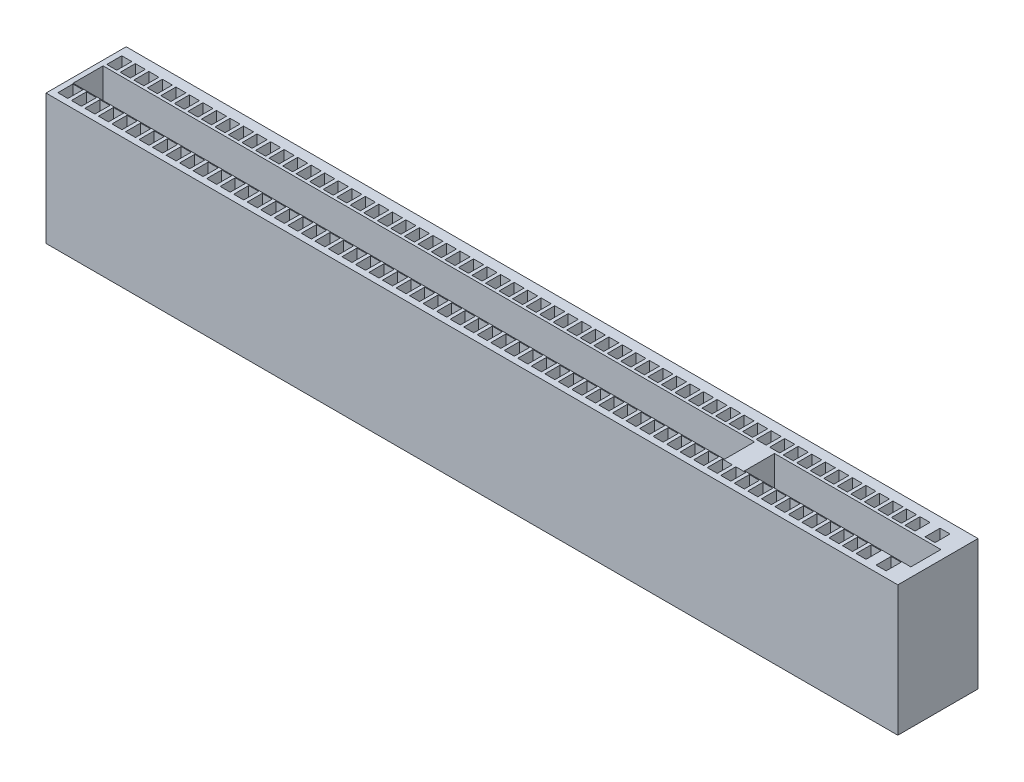
from build123d import *

# Parameters (mm, degrees)
SKETCH1_W           = 85
SKETCH1_H           = 8
BOSS_EXTRUDE1_DEPTH = 13
SKETCH2_W           = 2.481946124
SKETCH2_H           = 2.030683192
SKETCH2_W_2         = 2.594761857
SKETCH2_H_2         = 2.820393322
BOSS_EXTRUDE2_DEPTH = 1
SKETCH3_W           = 65
SKETCH3_H           = 3
SKETCH3_W_2         = 16.59944138
CUT_EXTRUDE2_DEPTH  = 10
SKETCH4_W           = 1
SKETCH4_H           = 1.5
CUT_EXTRUDE3_DEPTH  = 10


with BuildPart() as part:
    # Sketch1 → Boss-Extrude1 (new body)
    with BuildSketch(Plane(origin=(0, 0, 0), x_dir=(1, 0, 0), z_dir=(0, 1, 0))):
        with Locations((42.5, 4)):
            Rectangle(SKETCH1_W, SKETCH1_H)
    extrude(amount=BOSS_EXTRUDE1_DEPTH)

    # Sketch2 → Boss-Extrude2 (add)
    with BuildSketch(Plane.XZ):
        with Locations((81.308612117, -2.109090044)):
            Rectangle(SKETCH2_W, SKETCH2_H)
        with Locations((81.308612117, -6.283272161)):
            Rectangle(SKETCH2_W, SKETCH2_H)
        with Locations((3.74779575, -2.503945109)):
            Rectangle(SKETCH2_W_2, SKETCH2_H_2)
        with Locations((3.74779575, -6.283272161)):
            Rectangle(SKETCH2_W_2, SKETCH2_H)
    extrude(amount=BOSS_EXTRUDE2_DEPTH)

    # Sketch3 → Cut-Extrude2 (cut)
    with BuildSketch(Plane(origin=(0, 13, 0), x_dir=(1, 0, 0), z_dir=(0, 1, 0))):
        with Locations((33, 3.7)):
            Rectangle(SKETCH3_W, SKETCH3_H)
        with Locations((75.79972069, 3.7)):
            Rectangle(SKETCH3_W_2, SKETCH3_H)
    extrude(amount=-CUT_EXTRUDE2_DEPTH, mode=Mode.SUBTRACT)

    # Sketch4 → Cut-Extrude3 (cut)
    with BuildSketch(Plane(origin=(0, 13, 0), x_dir=(1, 0, 0), z_dir=(0, 1, 0))):
        with Locations((82.71113798, 6.25)):
            Rectangle(SKETCH4_W, SKETCH4_H)
        with Locations((80.71113798, 6.25)):
            Rectangle(SKETCH4_W, SKETCH4_H)
        with Locations((79.36113798, 6.25)):
            Rectangle(SKETCH4_W, SKETCH4_H)
        with Locations((78.01113798, 6.25)):
            Rectangle(SKETCH4_W, SKETCH4_H)
        with Locations((76.66113798, 6.25)):
            Rectangle(SKETCH4_W, SKETCH4_H)
        with Locations((75.31113798, 6.25)):
            Rectangle(SKETCH4_W, SKETCH4_H)
        with Locations((73.96113798, 6.25)):
            Rectangle(SKETCH4_W, SKETCH4_H)
        with Locations((72.61113798, 6.25)):
            Rectangle(SKETCH4_W, SKETCH4_H)
        with Locations((71.26113798, 6.25)):
            Rectangle(SKETCH4_W, SKETCH4_H)
        with Locations((69.91113798, 6.25)):
            Rectangle(SKETCH4_W, SKETCH4_H)
        with Locations((68.56113798, 6.25)):
            Rectangle(SKETCH4_W, SKETCH4_H)
        with Locations((67.21113798, 6.25)):
            Rectangle(SKETCH4_W, SKETCH4_H)
        with Locations((65.86113798, 6.25)):
            Rectangle(SKETCH4_W, SKETCH4_H)
        with Locations((64.51113798, 6.25)):
            Rectangle(SKETCH4_W, SKETCH4_H)
        with Locations((63.16113798, 6.25)):
            Rectangle(SKETCH4_W, SKETCH4_H)
        with Locations((61.81113798, 6.25)):
            Rectangle(SKETCH4_W, SKETCH4_H)
        with Locations((60.46113798, 6.25)):
            Rectangle(SKETCH4_W, SKETCH4_H)
        with Locations((59.11113798, 6.25)):
            Rectangle(SKETCH4_W, SKETCH4_H)
        with Locations((57.76113798, 6.25)):
            Rectangle(SKETCH4_W, SKETCH4_H)
        with Locations((56.41113798, 6.25)):
            Rectangle(SKETCH4_W, SKETCH4_H)
        with Locations((55.06113798, 6.25)):
            Rectangle(SKETCH4_W, SKETCH4_H)
        with Locations((53.71113798, 6.25)):
            Rectangle(SKETCH4_W, SKETCH4_H)
        with Locations((52.36113798, 6.25)):
            Rectangle(SKETCH4_W, SKETCH4_H)
        with Locations((51.01113798, 6.25)):
            Rectangle(SKETCH4_W, SKETCH4_H)
        with Locations((49.66113798, 6.25)):
            Rectangle(SKETCH4_W, SKETCH4_H)
        with Locations((48.31113798, 6.25)):
            Rectangle(SKETCH4_W, SKETCH4_H)
        with Locations((46.96113798, 6.25)):
            Rectangle(SKETCH4_W, SKETCH4_H)
        with Locations((45.61113798, 6.25)):
            Rectangle(SKETCH4_W, SKETCH4_H)
        with Locations((44.26113798, 6.25)):
            Rectangle(SKETCH4_W, SKETCH4_H)
        with Locations((42.91113798, 6.25)):
            Rectangle(SKETCH4_W, SKETCH4_H)
        with Locations((41.56113798, 6.25)):
            Rectangle(SKETCH4_W, SKETCH4_H)
        with Locations((40.21113798, 6.25)):
            Rectangle(SKETCH4_W, SKETCH4_H)
        with Locations((38.86113798, 6.25)):
            Rectangle(SKETCH4_W, SKETCH4_H)
        with Locations((37.51113798, 6.25)):
            Rectangle(SKETCH4_W, SKETCH4_H)
        with Locations((36.16113798, 6.25)):
            Rectangle(SKETCH4_W, SKETCH4_H)
        with Locations((34.81113798, 6.25)):
            Rectangle(SKETCH4_W, SKETCH4_H)
        with Locations((33.46113798, 6.25)):
            Rectangle(SKETCH4_W, SKETCH4_H)
        with Locations((32.11113798, 6.25)):
            Rectangle(SKETCH4_W, SKETCH4_H)
        with Locations((30.76113798, 6.25)):
            Rectangle(SKETCH4_W, SKETCH4_H)
        with Locations((29.41113798, 6.25)):
            Rectangle(SKETCH4_W, SKETCH4_H)
        with Locations((28.06113798, 6.25)):
            Rectangle(SKETCH4_W, SKETCH4_H)
        with Locations((26.71113798, 6.25)):
            Rectangle(SKETCH4_W, SKETCH4_H)
        with Locations((25.36113798, 6.25)):
            Rectangle(SKETCH4_W, SKETCH4_H)
        with Locations((24.01113798, 6.25)):
            Rectangle(SKETCH4_W, SKETCH4_H)
        with Locations((22.66113798, 6.25)):
            Rectangle(SKETCH4_W, SKETCH4_H)
        with Locations((21.31113798, 6.25)):
            Rectangle(SKETCH4_W, SKETCH4_H)
        with Locations((19.96113798, 6.25)):
            Rectangle(SKETCH4_W, SKETCH4_H)
        with Locations((18.61113798, 6.25)):
            Rectangle(SKETCH4_W, SKETCH4_H)
        with Locations((17.26113798, 6.25)):
            Rectangle(SKETCH4_W, SKETCH4_H)
        with Locations((15.91113798, 6.25)):
            Rectangle(SKETCH4_W, SKETCH4_H)
        with Locations((14.56113798, 6.25)):
            Rectangle(SKETCH4_W, SKETCH4_H)
        with Locations((13.21113798, 6.25)):
            Rectangle(SKETCH4_W, SKETCH4_H)
        with Locations((11.86113798, 6.25)):
            Rectangle(SKETCH4_W, SKETCH4_H)
        with Locations((10.51113798, 6.25)):
            Rectangle(SKETCH4_W, SKETCH4_H)
        with Locations((9.16113798, 6.25)):
            Rectangle(SKETCH4_W, SKETCH4_H)
        with Locations((7.81113798, 6.25)):
            Rectangle(SKETCH4_W, SKETCH4_H)
        with Locations((6.46113798, 6.25)):
            Rectangle(SKETCH4_W, SKETCH4_H)
        with Locations((5.11113798, 6.25)):
            Rectangle(SKETCH4_W, SKETCH4_H)
        with Locations((3.76113798, 6.25)):
            Rectangle(SKETCH4_W, SKETCH4_H)
        with Locations((2.41113798, 6.25)):
            Rectangle(SKETCH4_W, SKETCH4_H)
        with Locations((1.06113798, 6.25)):
            Rectangle(SKETCH4_W, SKETCH4_H)
        with Locations((1.06113798, 1.370144263)):
            Rectangle(SKETCH4_W, SKETCH4_H)
        with Locations((2.41113798, 1.370144263)):
            Rectangle(SKETCH4_W, SKETCH4_H)
        with Locations((3.76113798, 1.370144263)):
            Rectangle(SKETCH4_W, SKETCH4_H)
        with Locations((5.11113798, 1.370144263)):
            Rectangle(SKETCH4_W, SKETCH4_H)
        with Locations((6.46113798, 1.370144263)):
            Rectangle(SKETCH4_W, SKETCH4_H)
        with Locations((7.81113798, 1.370144263)):
            Rectangle(SKETCH4_W, SKETCH4_H)
        with Locations((9.16113798, 1.370144263)):
            Rectangle(SKETCH4_W, SKETCH4_H)
        with Locations((10.51113798, 1.370144263)):
            Rectangle(SKETCH4_W, SKETCH4_H)
        with Locations((11.86113798, 1.370144263)):
            Rectangle(SKETCH4_W, SKETCH4_H)
        with Locations((13.21113798, 1.370144263)):
            Rectangle(SKETCH4_W, SKETCH4_H)
        with Locations((14.56113798, 1.370144263)):
            Rectangle(SKETCH4_W, SKETCH4_H)
        with Locations((15.91113798, 1.370144263)):
            Rectangle(SKETCH4_W, SKETCH4_H)
        with Locations((17.26113798, 1.370144263)):
            Rectangle(SKETCH4_W, SKETCH4_H)
        with Locations((18.61113798, 1.370144263)):
            Rectangle(SKETCH4_W, SKETCH4_H)
        with Locations((19.96113798, 1.370144263)):
            Rectangle(SKETCH4_W, SKETCH4_H)
        with Locations((21.31113798, 1.370144263)):
            Rectangle(SKETCH4_W, SKETCH4_H)
        with Locations((22.66113798, 1.370144263)):
            Rectangle(SKETCH4_W, SKETCH4_H)
        with Locations((24.01113798, 1.370144263)):
            Rectangle(SKETCH4_W, SKETCH4_H)
        with Locations((25.36113798, 1.370144263)):
            Rectangle(SKETCH4_W, SKETCH4_H)
        with Locations((26.71113798, 1.370144263)):
            Rectangle(SKETCH4_W, SKETCH4_H)
        with Locations((28.06113798, 1.370144263)):
            Rectangle(SKETCH4_W, SKETCH4_H)
        with Locations((29.41113798, 1.370144263)):
            Rectangle(SKETCH4_W, SKETCH4_H)
        with Locations((30.76113798, 1.370144263)):
            Rectangle(SKETCH4_W, SKETCH4_H)
        with Locations((32.11113798, 1.370144263)):
            Rectangle(SKETCH4_W, SKETCH4_H)
        with Locations((33.46113798, 1.370144263)):
            Rectangle(SKETCH4_W, SKETCH4_H)
        with Locations((34.81113798, 1.370144263)):
            Rectangle(SKETCH4_W, SKETCH4_H)
        with Locations((36.16113798, 1.370144263)):
            Rectangle(SKETCH4_W, SKETCH4_H)
        with Locations((37.51113798, 1.370144263)):
            Rectangle(SKETCH4_W, SKETCH4_H)
        with Locations((38.86113798, 1.370144263)):
            Rectangle(SKETCH4_W, SKETCH4_H)
        with Locations((40.21113798, 1.370144263)):
            Rectangle(SKETCH4_W, SKETCH4_H)
        with Locations((41.56113798, 1.370144263)):
            Rectangle(SKETCH4_W, SKETCH4_H)
        with Locations((42.91113798, 1.370144263)):
            Rectangle(SKETCH4_W, SKETCH4_H)
        with Locations((44.26113798, 1.370144263)):
            Rectangle(SKETCH4_W, SKETCH4_H)
        with Locations((45.61113798, 1.370144263)):
            Rectangle(SKETCH4_W, SKETCH4_H)
        with Locations((46.96113798, 1.370144263)):
            Rectangle(SKETCH4_W, SKETCH4_H)
        with Locations((48.31113798, 1.370144263)):
            Rectangle(SKETCH4_W, SKETCH4_H)
        with Locations((49.66113798, 1.370144263)):
            Rectangle(SKETCH4_W, SKETCH4_H)
        with Locations((51.01113798, 1.370144263)):
            Rectangle(SKETCH4_W, SKETCH4_H)
        with Locations((52.36113798, 1.370144263)):
            Rectangle(SKETCH4_W, SKETCH4_H)
        with Locations((53.71113798, 1.370144263)):
            Rectangle(SKETCH4_W, SKETCH4_H)
        with Locations((55.06113798, 1.370144263)):
            Rectangle(SKETCH4_W, SKETCH4_H)
        with Locations((56.41113798, 1.370144263)):
            Rectangle(SKETCH4_W, SKETCH4_H)
        with Locations((57.76113798, 1.370144263)):
            Rectangle(SKETCH4_W, SKETCH4_H)
        with Locations((59.11113798, 1.370144263)):
            Rectangle(SKETCH4_W, SKETCH4_H)
        with Locations((60.46113798, 1.370144263)):
            Rectangle(SKETCH4_W, SKETCH4_H)
        with Locations((61.81113798, 1.370144263)):
            Rectangle(SKETCH4_W, SKETCH4_H)
        with Locations((63.16113798, 1.370144263)):
            Rectangle(SKETCH4_W, SKETCH4_H)
        with Locations((64.51113798, 1.370144263)):
            Rectangle(SKETCH4_W, SKETCH4_H)
        with Locations((65.86113798, 1.370144263)):
            Rectangle(SKETCH4_W, SKETCH4_H)
        with Locations((67.21113798, 1.370144263)):
            Rectangle(SKETCH4_W, SKETCH4_H)
        with Locations((68.56113798, 1.370144263)):
            Rectangle(SKETCH4_W, SKETCH4_H)
        with Locations((69.91113798, 1.370144263)):
            Rectangle(SKETCH4_W, SKETCH4_H)
        with Locations((71.26113798, 1.370144263)):
            Rectangle(SKETCH4_W, SKETCH4_H)
        with Locations((72.61113798, 1.370144263)):
            Rectangle(SKETCH4_W, SKETCH4_H)
        with Locations((73.96113798, 1.370144263)):
            Rectangle(SKETCH4_W, SKETCH4_H)
        with Locations((75.31113798, 1.370144263)):
            Rectangle(SKETCH4_W, SKETCH4_H)
        with Locations((76.66113798, 1.370144263)):
            Rectangle(SKETCH4_W, SKETCH4_H)
        with Locations((78.01113798, 1.370144263)):
            Rectangle(SKETCH4_W, SKETCH4_H)
        with Locations((79.36113798, 1.370144263)):
            Rectangle(SKETCH4_W, SKETCH4_H)
        with Locations((80.71113798, 1.370144263)):
            Rectangle(SKETCH4_W, SKETCH4_H)
        with Locations((82.71113798, 1.370144263)):
            Rectangle(SKETCH4_W, SKETCH4_H)
    extrude(amount=-CUT_EXTRUDE3_DEPTH, mode=Mode.SUBTRACT)


solid = part.part
